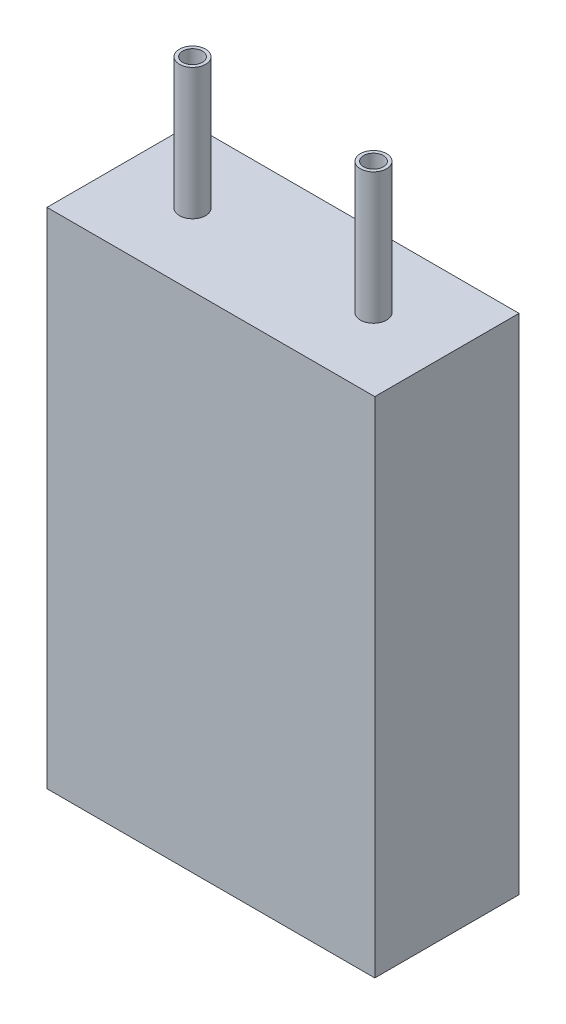
from build123d import *

# Parameters (mm, degrees)
SKETCH1_W           = 63.5
SKETCH1_H           = 27.94
BOSS_EXTRUDE1_DEPTH = 97.536
SKETCH2_R           = 2.54
SKETCH2_R_2         = 1.905
BOSS_EXTRUDE2_DEPTH = 25.4


with BuildPart() as part:
    # Sketch1 → Boss-Extrude1 (new body)
    with BuildSketch(Plane(origin=(0, 0, 0), x_dir=(1, 0, 0), z_dir=(0, 1, 0))):
        with Locations((31.75, -13.97)):
            Rectangle(SKETCH1_W, SKETCH1_H)
    extrude(amount=BOSS_EXTRUDE1_DEPTH)

    # Sketch2 → Boss-Extrude2 (add)
    # profile 1 of 2: a face of its own
    with BuildSketch(Plane(origin=(0, 97.536, 0), x_dir=(1, 0, 0), z_dir=(0, 1, 0))):
        with Locations(Location((14.224, -13.97, 0), (0, 0, 270))):
            Circle(SKETCH2_R)
        with Locations(Location((14.224, -13.97, 0), (0, 0, 270))):
            Circle(SKETCH2_R_2, mode=Mode.SUBTRACT)
    # profile 2 of 2: a face of its own
    with BuildSketch(Plane(origin=(0, 97.536, 0), x_dir=(1, 0, 0), z_dir=(0, 1, 0))):
        with Locations(Location((49.276, -13.97, 0), (0, 0, 270))):
            Circle(SKETCH2_R)
        with Locations(Location((49.276, -13.97, 0), (0, 0, 270))):
            Circle(SKETCH2_R_2, mode=Mode.SUBTRACT)
    extrude(amount=BOSS_EXTRUDE2_DEPTH)


solid = part.part
